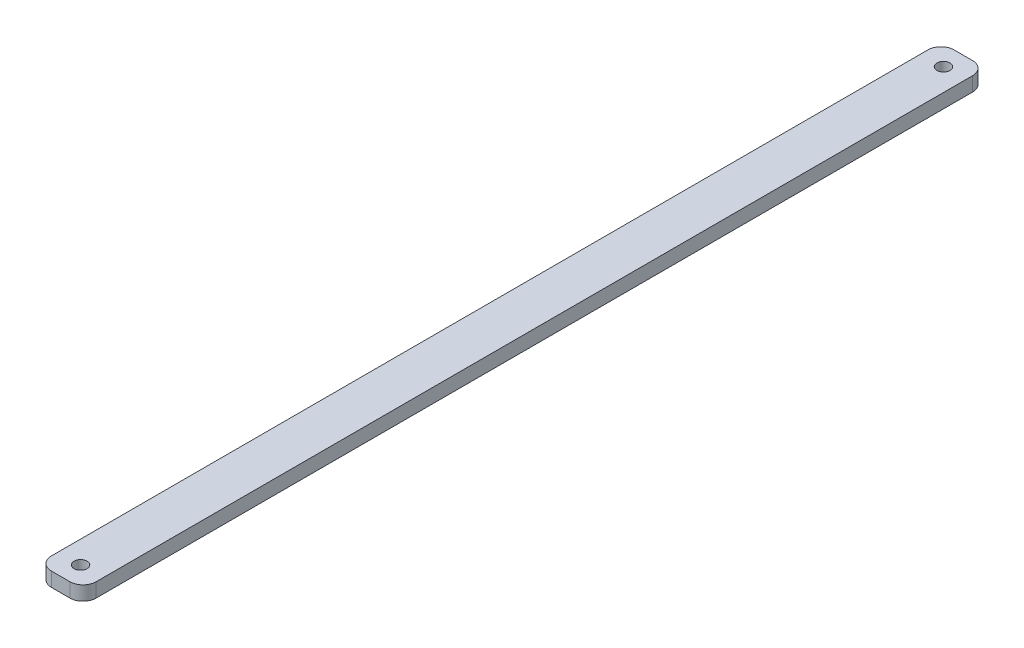
from build123d import *

# Parameters (mm, degrees)
SKETCH1_W           = 10
SKETCH1_H           = 201.93
SKETCH1_R           = 1.4605
BOSS_EXTRUDE1_DEPTH = 3.175
FILLET1_R           = 2.921


with BuildPart() as part:
    # Sketch1 → Boss-Extrude1 (new body)
    with BuildSketch(Plane(origin=(0, 0, 0), x_dir=(1, 0, 0), z_dir=(0, 1, 0))):
        Rectangle(SKETCH1_W, SKETCH1_H)
        with Locations(Location((0, 96.52, 0), (0, 0, 270))):
            Circle(SKETCH1_R, mode=Mode.SUBTRACT)
        with Locations(Location((0, -96.52, 0), (0, 0, 270))):
            Circle(SKETCH1_R, mode=Mode.SUBTRACT)
    extrude(amount=BOSS_EXTRUDE1_DEPTH)

    # Fillet1
    fillet1_edges = [part.edges().sort_by_distance(p)[0] for p in [
        (5, 1.5875, 100.965),
        (-5, 1.5875, 100.965),
        (-5, 1.5875, -100.965),
        (5, 1.5875, -100.965),
    ]]
    fillet(fillet1_edges, radius=FILLET1_R)


solid = part.part
